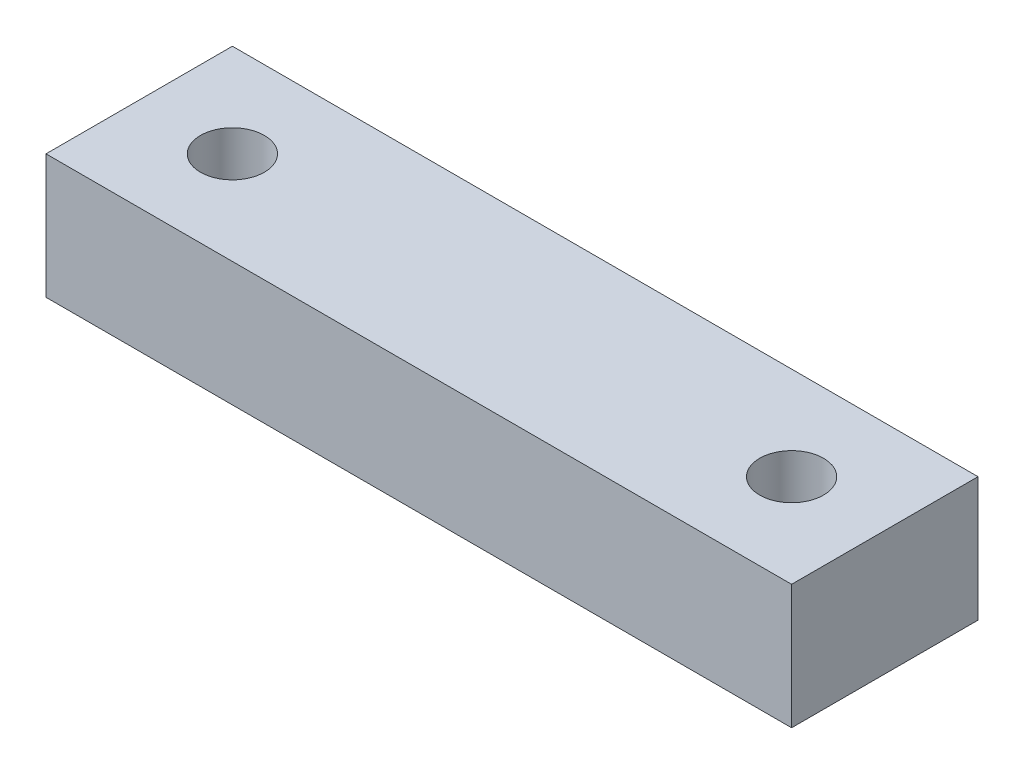
from build123d import *

# Parameters (mm, degrees)
SKETCH1_W             = 38.1
SKETCH1_H             = 9.525
BOSS_EXTRUDE1_DEPTH   = 6.35
F_4_CLEARANCE_HOLE1_D = 3.2639


with BuildPart() as part:
    # Sketch1 → Boss-Extrude1 (new body)
    with BuildSketch(Plane(origin=(0, 0, 0), x_dir=(1, 0, 0), z_dir=(0, 1, 0))):
        Rectangle(SKETCH1_W, SKETCH1_H)
    extrude(amount=BOSS_EXTRUDE1_DEPTH)

    # #4 Clearance Hole1 (through all)
    with Locations(Plane(origin=(0, 6.35, 0), x_dir=(1, 0, 0), z_dir=(0, 1, 0))):
        with Locations((-14.2875, 0)):
            f_4_clearance_hole1 = Hole(F_4_CLEARANCE_HOLE1_D / 2)

    # Mirror1: #4 Clearance Hole1 across plane
    add(f_4_clearance_hole1.mirror(Plane(origin=(0, 0, 0), x_dir=(0, 0, 1), z_dir=(1, 0, 0))), mode=Mode.SUBTRACT)


solid = part.part
